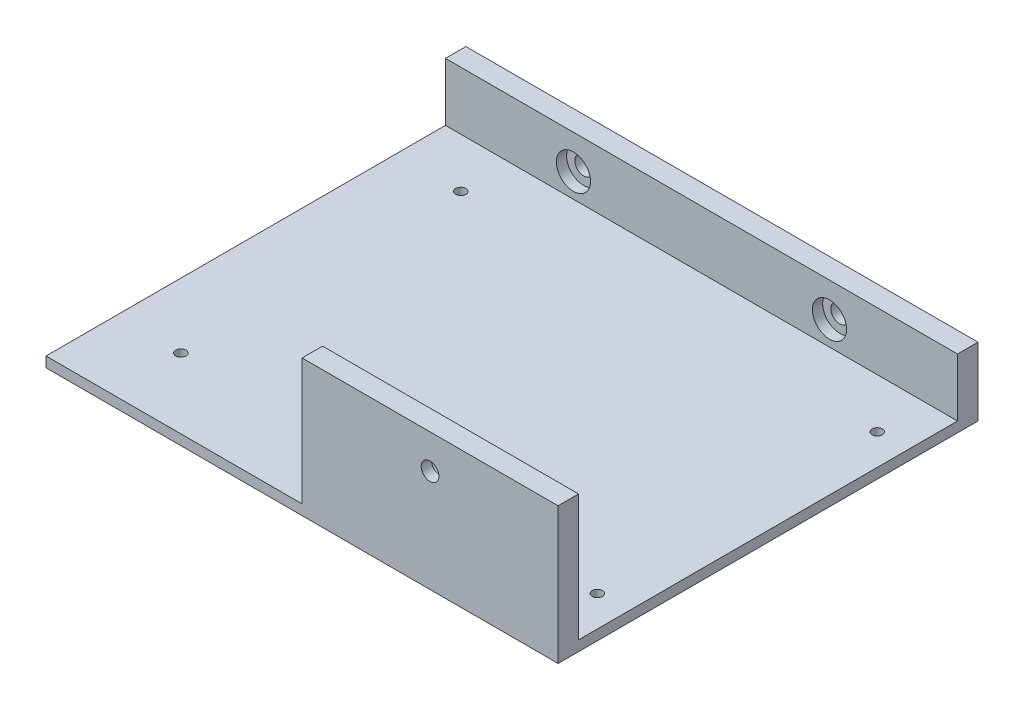
from build123d import *

# Parameters (mm, degrees)
SKETCH_1_W          = 150
SKETCH_1_H          = 123
SKETCH_1_R          = 1.5
EXTRUDE_1_DEPTH     = 3
SKETCH_2_W          = 150
SKETCH_2_H          = 6
EXTRUDE_2_DEPTH     = 17
SKETCH_3_W          = 75
SKETCH_3_H          = 6
EXTRUDE_3_DEPTH     = 37
CUT_EXTRUDE_1_DEPTH = 37
SKETCH_5_R          = 5
CUT_EXTRUDE_2_DEPTH = 3
CUT_EXTRUDE_3_DEPTH = 6
SKETCH_7_R          = 5
CUT_EXTRUDE_4_DEPTH = 3


with BuildPart() as part:
    # 草图1 → 凸台-拉伸1 (new body)
    with BuildSketch(Plane(origin=(0, 0, 0), x_dir=(1, 0, 0), z_dir=(0, 1, 0))):
        with Locations((75, 61.5)):
            Rectangle(SKETCH_1_W, SKETCH_1_H)
        with Locations(Location((19, 102.5, 0), (0, 0, 270))):
            Circle(SKETCH_1_R, mode=Mode.SUBTRACT)
        with Locations(Location((19, 20.5, 0), (0, 0, 270))):
            Circle(SKETCH_1_R, mode=Mode.SUBTRACT)
        with Locations(Location((141, 20.5, 0), (0, 0, 270))):
            Circle(SKETCH_1_R, mode=Mode.SUBTRACT)
        with Locations(Location((141, 102.5, 0), (0, 0, 270))):
            Circle(SKETCH_1_R, mode=Mode.SUBTRACT)
    extrude(amount=EXTRUDE_1_DEPTH)

    # 草图2 → 凸台-拉伸2 (add)
    with BuildSketch(Plane(origin=(0, 3, 0), x_dir=(1, 0, 0), z_dir=(0, 1, 0))):
        with Locations((75, 120)):
            Rectangle(SKETCH_2_W, SKETCH_2_H)
    extrude(amount=EXTRUDE_2_DEPTH)

    # 草图3 → 凸台-拉伸3 (add)
    with BuildSketch(Plane(origin=(0, 3, 0), x_dir=(1, 0, 0), z_dir=(0, 1, 0))):
        with Locations((112.5, 3)):
            Rectangle(SKETCH_3_W, SKETCH_3_H)
    extrude(amount=EXTRUDE_3_DEPTH)

    # 草图4 → 切除-拉伸1 (cut)
    with BuildSketch(Plane(origin=(0, 0, -6), x_dir=(-1, 0, 0), z_dir=(0, 0, -1))):
        with BuildLine():
            ThreePointArc((-109.987789157, 30.669922891), (-113.169922891, 32.512210843), (-115.012210843, 29.330077109))
            Line((-115.012210843, 29.330077109), (-109.987789157, 30.669922891))
        make_face()
        with BuildLine():
            Line((-109.987789157, 30.669922891), (-115.012210843, 29.330077109))
            ThreePointArc((-115.012210843, 29.330077109), (-112.162174743, 27.422040711), (-109.9, 30))
            ThreePointArc((-109.9, 30), (-109.922040711, 30.337825257), (-109.987789157, 30.669922891))
        make_face()
    extrude(amount=-CUT_EXTRUDE_1_DEPTH, mode=Mode.SUBTRACT)

    # 草图5 → 切除-拉伸2 (cut)
    with BuildSketch(Plane(origin=(0, 0, -6), x_dir=(-1, 0, 0), z_dir=(0, 0, -1))):
        with Locations((-112.5, 30)):
            Circle(SKETCH_5_R)
    extrude(amount=-CUT_EXTRUDE_2_DEPTH, mode=Mode.SUBTRACT)

    # 草图6 → 切除-拉伸3 (cut)
    with BuildSketch(Plane(origin=(0, 0, -123), x_dir=(-1, 0, 0), z_dir=(0, 0, -1))):
        with BuildLine():
            ThreePointArc((-115.1, 10), (-112.5, 7.4), (-109.9, 10))
            Line((-109.9, 10), (-115.1, 10))
        make_face()
        with BuildLine():
            Line((-115.1, 10), (-109.9, 10))
            ThreePointArc((-109.9, 10), (-112.5, 12.6), (-115.1, 10))
        make_face()
        with BuildLine():
            ThreePointArc((-34.9, 10), (-37.5, 12.6), (-40.1, 10))
            Line((-40.1, 10), (-34.9, 10))
        make_face()
        with BuildLine():
            Line((-34.9, 10), (-40.1, 10))
            ThreePointArc((-40.1, 10), (-37.5, 7.4), (-34.9, 10))
        make_face()
    extrude(amount=-CUT_EXTRUDE_3_DEPTH, mode=Mode.SUBTRACT)

    # 草图7 → 切除-拉伸4 (cut)
    with BuildSketch(Plane.XY.offset(-117)):
        with Locations((37.5, 10)):
            Circle(SKETCH_7_R)
        with Locations((112.5, 10)):
            Circle(SKETCH_7_R)
    extrude(amount=-CUT_EXTRUDE_4_DEPTH, mode=Mode.SUBTRACT)


solid = part.part
